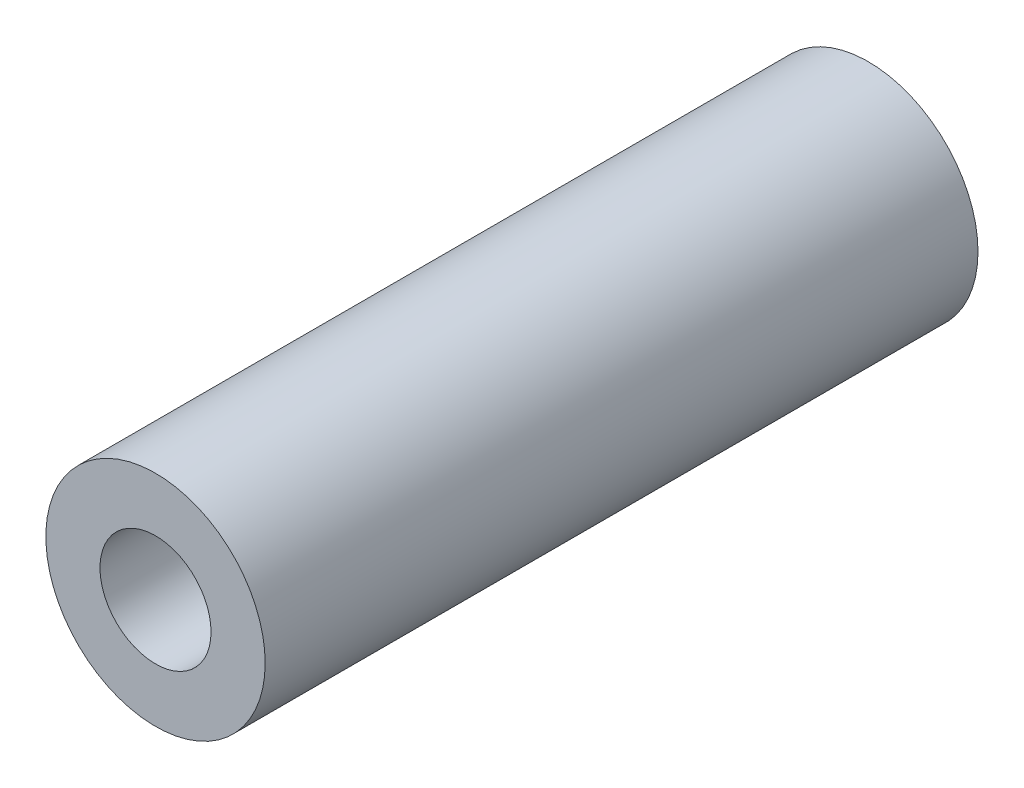
from build123d import *

# Parameters (mm, degrees)
S01_SOLID_POST_BLANK_16_MM_R             = 8
F_01_SOLID_POST_BLANK_16_MM_DEPTH        = 52
F_02_START                               = -0.1
S02_REAR_M6_HEAT_SET_INSERT_SEAT_R       = 4.05
F_02_REAR_M6_HEAT_SET_INSERT_SEAT_DEPTH  = 14.35
F_03_START                               = 37.75
S03_FRONT_M6_HEAT_SET_INSERT_SEAT_R      = 4.05
F_03_FRONT_M6_HEAT_SET_INSERT_SEAT_DEPTH = 14.35


with BuildPart() as part:
    # S01 - Solid post blank - 16 mm → 01 - Solid post blank - 16 mm (new body)
    with BuildSketch(Plane.XY):
        Circle(S01_SOLID_POST_BLANK_16_MM_R)
    extrude(amount=F_01_SOLID_POST_BLANK_16_MM_DEPTH)

    # S02 - Rear M6 heat-set insert seat → 02 - Rear M6 heat-set insert seat (cut)
    with BuildSketch(Plane.XY.offset(F_02_START)):
        Circle(S02_REAR_M6_HEAT_SET_INSERT_SEAT_R)
    extrude(amount=F_02_REAR_M6_HEAT_SET_INSERT_SEAT_DEPTH, mode=Mode.SUBTRACT)

    # S03 - Front M6 heat-set insert seat → 03 - Front M6 heat-set insert seat (cut)
    with BuildSketch(Plane.XY.offset(F_03_START)):
        Circle(S03_FRONT_M6_HEAT_SET_INSERT_SEAT_R)
    extrude(amount=F_03_FRONT_M6_HEAT_SET_INSERT_SEAT_DEPTH, mode=Mode.SUBTRACT)


solid = part.part
